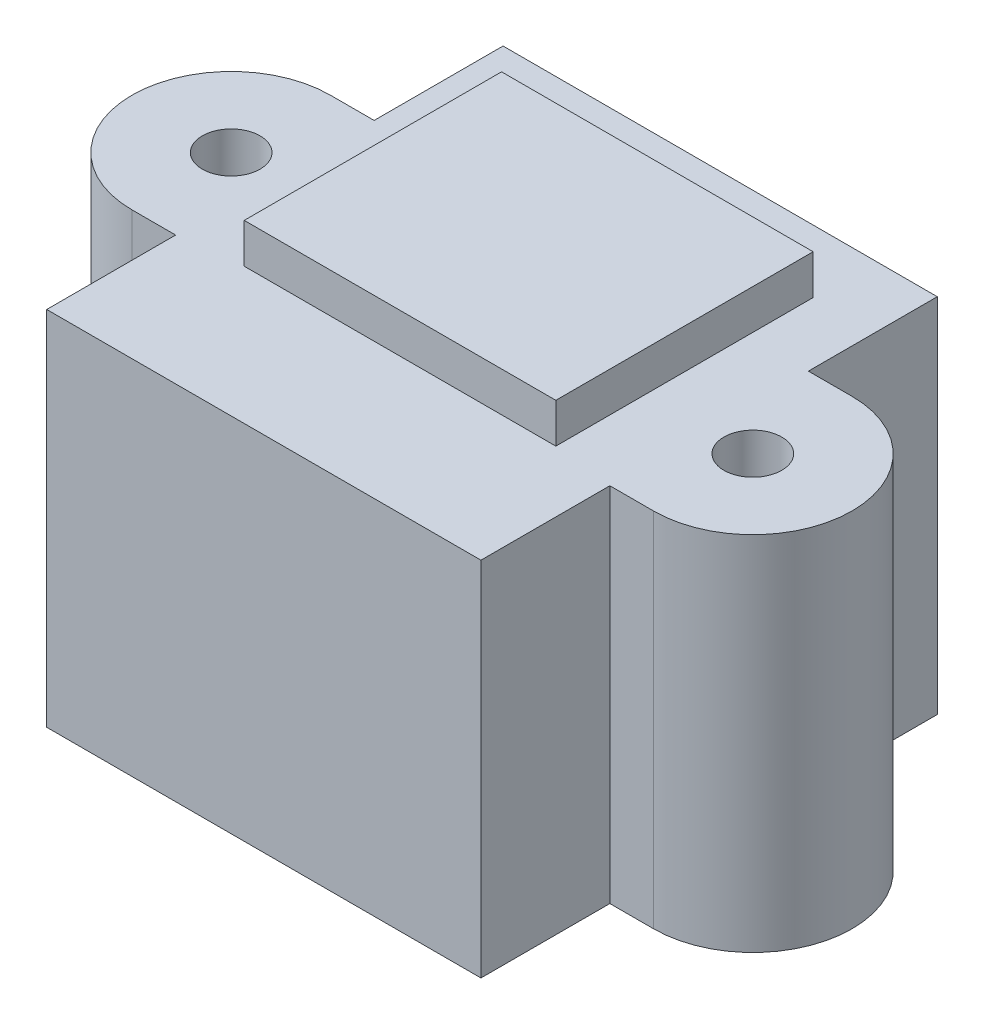
from build123d import *

# Parameters (mm, degrees)
SKETCH1_W           = 21.9456
SKETCH1_H           = 10.033
SKETCH1_H_2         = 6.5151
BOSS_EXTRUDE1_DEPTH = 18.288
SKETCH2_W           = 15.748
SKETCH2_H           = 13.0048
BOSS_EXTRUDE2_DEPTH = 2.0066
SKETCH3_R           = 1.4605
CUT_EXTRUDE1_DEPTH  = 29.260148325


with BuildPart() as part:
    # Sketch1 → Boss-Extrude1 (new body)
    with BuildSketch(Plane(origin=(0, 0, 0), x_dir=(1, 0, 0), z_dir=(0, 1, 0))):
        with BuildLine():
            Line((-13.1826, -5.0165), (-10.9728, -5.0165))
            Line((-10.9728, -5.0165), (-10.9728, 5.0165))
            Line((-10.9728, 5.0165), (-13.1826, 5.0165))
            ThreePointArc((-13.1826, 5.0165), (-18.1991, 0), (-13.1826, -5.0165))
        make_face()
        Rectangle(SKETCH1_W, SKETCH1_H)
        with Locations((0, -8.27405)):
            Rectangle(SKETCH1_W, SKETCH1_H_2)
        with BuildLine():
            Line((10.9728, 5.0165), (10.9728, -5.0165))
            Line((10.9728, -5.0165), (13.1826, -5.0165))
            ThreePointArc((13.1826, -5.0165), (18.1991, 0), (13.1826, 5.0165))
            Line((13.1826, 5.0165), (10.9728, 5.0165))
        make_face()
        with Locations((0, 8.27405)):
            Rectangle(SKETCH1_W, SKETCH1_H_2)
    extrude(amount=BOSS_EXTRUDE1_DEPTH)

    # Sketch2 → Boss-Extrude2 (add)
    with BuildSketch(Plane(origin=(0, 18.288, 0), x_dir=(1, 0, 0), z_dir=(0, 1, 0))):
        with Locations((0, 1.8542)):
            Rectangle(SKETCH2_W, SKETCH2_H)
    extrude(amount=BOSS_EXTRUDE2_DEPTH)

    # Sketch3 → Cut-Extrude1 (cut, through all)
    with BuildSketch(Plane(origin=(0, 18.288, 0), x_dir=(1, 0, 0), z_dir=(0, 1, 0))):
        with Locations(Location((-13.1826, 0, 0), (0, 0, 270))):
            Circle(SKETCH3_R)
        with Locations(Location((13.1826, 0, 0), (0, 0, 270))):
            Circle(SKETCH3_R)
    extrude(amount=-CUT_EXTRUDE1_DEPTH, mode=Mode.SUBTRACT)


solid = part.part
